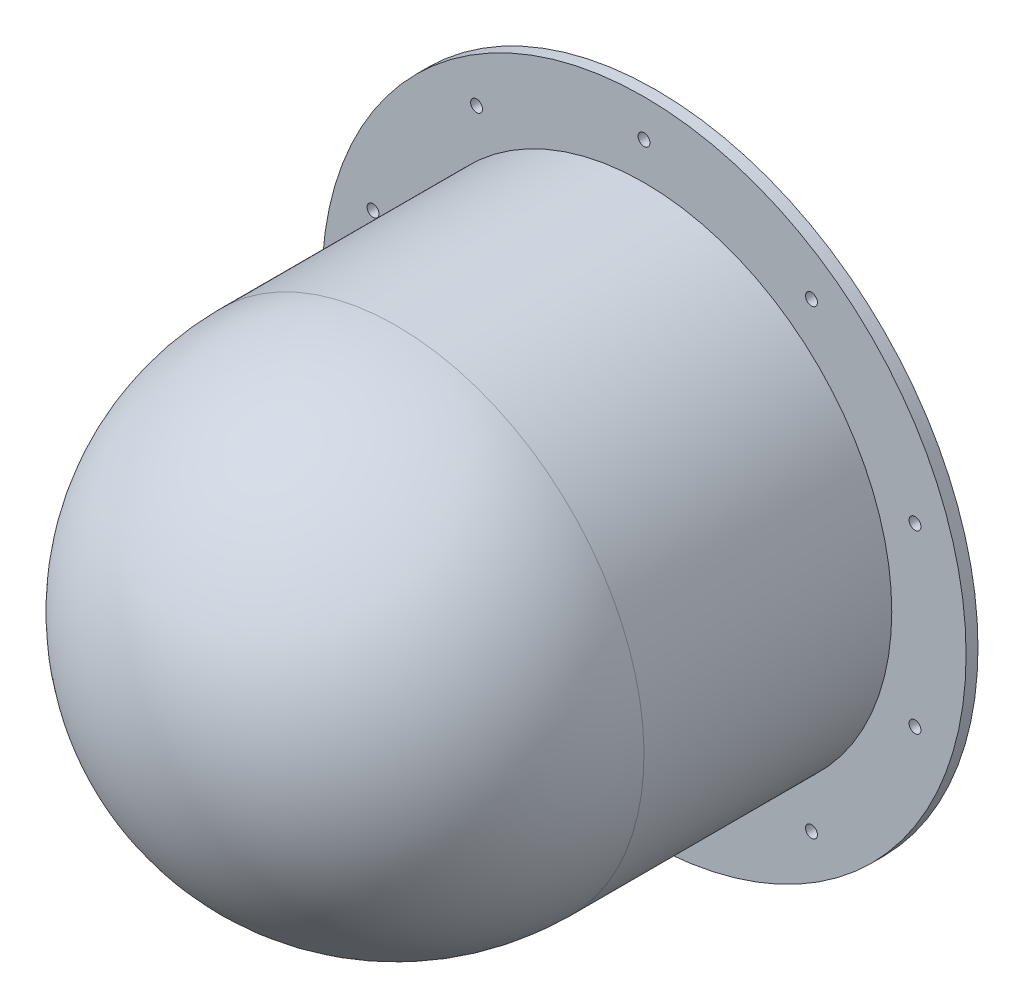
from build123d import *

# Parameters (mm, degrees)
SKETCH1_R           = 325
SKETCH1_R_2         = 6
SKETCH1_R_3         = 244
BOSS_EXTRUDE1_DEPTH = 12


with BuildPart() as part:
    # Sketch1 → Boss-Extrude1 (new body)
    with BuildSketch(Plane.XY):
        Circle(SKETCH1_R)
        with Locations((0, 287.5)):
            Circle(SKETCH1_R_2, mode=Mode.SUBTRACT)
        with Locations((168.988260034, 232.592385883)):
            Circle(SKETCH1_R_2, mode=Mode.SUBTRACT)
        with Locations((273.428748435, 88.842385883)):
            Circle(SKETCH1_R_2, mode=Mode.SUBTRACT)
        with Locations((273.428748435, -88.842385883)):
            Circle(SKETCH1_R_2, mode=Mode.SUBTRACT)
        with Locations((168.988260034, -232.592385883)):
            Circle(SKETCH1_R_2, mode=Mode.SUBTRACT)
        with Locations((0, -287.5)):
            Circle(SKETCH1_R_2, mode=Mode.SUBTRACT)
        with Locations((-168.988260034, -232.592385883)):
            Circle(SKETCH1_R_2, mode=Mode.SUBTRACT)
        with Locations((-273.428748435, -88.842385883)):
            Circle(SKETCH1_R_2, mode=Mode.SUBTRACT)
        with Locations((-273.428748435, 88.842385883)):
            Circle(SKETCH1_R_2, mode=Mode.SUBTRACT)
        with Locations((-168.988260034, 232.592385883)):
            Circle(SKETCH1_R_2, mode=Mode.SUBTRACT)
        Circle(SKETCH1_R_3, mode=Mode.SUBTRACT)
    extrude(amount=BOSS_EXTRUDE1_DEPTH)

    # Sketch4 → Revolve2 (revolve)
    with BuildSketch(Plane(origin=(0, 0, 0), x_dir=(0, 0, -1), z_dir=(1, 0, 0))):
        with BuildLine():
            Line((-12, 250), (-262, 250))
            ThreePointArc((-262, 250), (-438.776695297, 176.776695297), (-512, 0))
            Line((-512, 0), (-506, 0))
            ThreePointArc((-506, 0), (-434.53405461, 172.53405461), (-262, 244))
            Line((-262, 244), (-12, 244))
            Line((-12, 244), (-12, 250))
        make_face()
    revolve(axis=Axis((0, 0, 12), (0, 0, 1)))


solid = part.part
